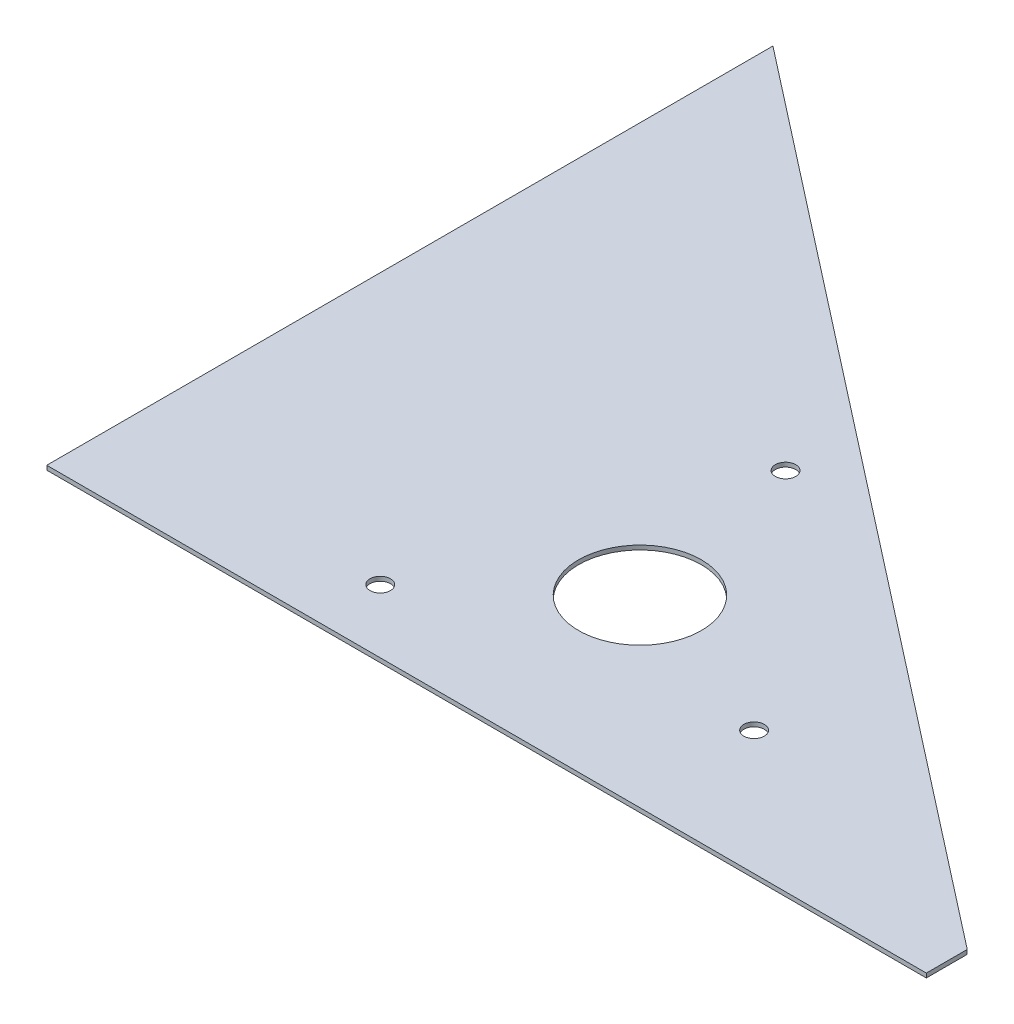
from build123d import *

# Parameters (mm, degrees)
BOSS_EXTRUDE1_DEPTH = 2.65684
SKETCH2_R           = 38.1
CUT_EXTRUDE1_DEPTH  = 709.165228812
SKETCH3_R           = 6.35
CUT_EXTRUDE2_DEPTH  = 709.165228812


with BuildPart() as part:
    # Sketch1 → Boss-Extrude1 (new body)
    with BuildSketch(Plane(origin=(0, 0, 0), x_dir=(1, 0, 0), z_dir=(0, 1, 0))):
        Polygon((0, 450.85), (0, 0), (546.1, 0), (546.1, 25.4), align=None)
    extrude(amount=BOSS_EXTRUDE1_DEPTH)

    # Sketch2 → Cut-Extrude1 (cut, through all)
    with BuildSketch(Plane.XZ):
        with Locations(Location((254, -114.3, 0), (0, 0, 270))):
            Circle(SKETCH2_R)
    extrude(amount=-CUT_EXTRUDE1_DEPTH, mode=Mode.SUBTRACT)

    # Sketch3 → Cut-Extrude2 (cut, through all)
    with BuildSketch(Plane(origin=(0, 2.65684, 0), x_dir=(1, 0, 0), z_dir=(0, 1, 0))):
        with Locations(Location((362.072773191, 77.087559946, 0), (0, 0, 270))):
            Circle(SKETCH3_R)
        with Locations(Location((167.736694981, 39.312452986, 0), (0, 0, 270))):
            Circle(SKETCH3_R)
        with Locations(Location((232.190531828, 226.499987068, 0), (0, 0, 270))):
            Circle(SKETCH3_R)
    extrude(amount=-CUT_EXTRUDE2_DEPTH, mode=Mode.SUBTRACT)


solid = part.part
